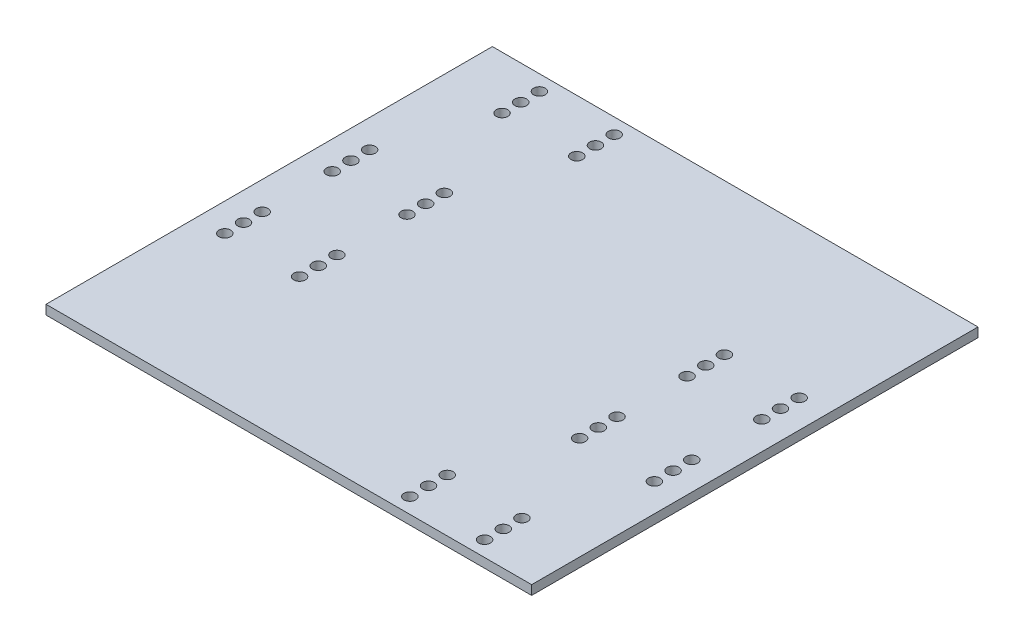
from build123d import *

# Parameters (mm, degrees)
CROQUIS1_W              = 330
CROQUIS1_H              = 303.31
SALIENTE_EXTRUIR2_DEPTH = 6.35
CROQUIS4_R              = 3.96875
CORTAR_EXTRUIR1_DEPTH   = 10


with BuildPart() as part:
    # Croquis1 → Saliente-Extruir2 (new body)
    with BuildSketch(Plane(origin=(0, 0, 0), x_dir=(1, 0, 0), z_dir=(0, 1, 0))):
        Rectangle(CROQUIS1_W, CROQUIS1_H)
    extrude(amount=SALIENTE_EXTRUIR2_DEPTH)

    # Croquis4 → Cortar-Extruir1 (cut)
    with BuildSketch(Plane(origin=(0, 6.35, 0), x_dir=(1, 0, 0), z_dir=(0, 1, 0))):
        with Locations(Location((122.58, -128.507, 0), (0, 0, 270))):
            Circle(CROQUIS4_R)
        with Locations(Location((122.58, -115.807, 0), (0, 0, 270))):
            Circle(CROQUIS4_R)
        with Locations(Location((122.58, -141.207, 0), (0, 0, 270))):
            Circle(CROQUIS4_R)
        with Locations(Location((71.78, -141.207, 0), (0, 0, 270))):
            Circle(CROQUIS4_R)
        with Locations(Location((71.78, -128.507, 0), (0, 0, 270))):
            Circle(CROQUIS4_R)
        with Locations(Location((71.78, -115.807, 0), (0, 0, 270))):
            Circle(CROQUIS4_R)
        with Locations(Location((95.15, -36.499, 0), (0, 0, 270))):
            Circle(CROQUIS4_R)
        with Locations(Location((95.15, -23.799, 0), (0, 0, 270))):
            Circle(CROQUIS4_R)
        with Locations(Location((95.15, -49.199, 0), (0, 0, 270))):
            Circle(CROQUIS4_R)
        with Locations(Location((145.95, -49.199, 0), (0, 0, 270))):
            Circle(CROQUIS4_R)
        with Locations(Location((145.95, -36.499, 0), (0, 0, 270))):
            Circle(CROQUIS4_R)
        with Locations(Location((145.95, -23.799, 0), (0, 0, 270))):
            Circle(CROQUIS4_R)
        with Locations(Location((145.95, 49.199, 0), (0, 0, 270))):
            Circle(CROQUIS4_R)
        with Locations(Location((95.15, 49.199, 0), (0, 0, 270))):
            Circle(CROQUIS4_R)
        with Locations(Location((145.95, 36.499, 0), (0, 0, 270))):
            Circle(CROQUIS4_R)
        with Locations(Location((95.15, 36.499, 0), (0, 0, 270))):
            Circle(CROQUIS4_R)
        with Locations(Location((145.95, 23.799, 0), (0, 0, 270))):
            Circle(CROQUIS4_R)
        with Locations(Location((95.15, 23.799, 0), (0, 0, 270))):
            Circle(CROQUIS4_R)
        with Locations(Location((-95.15, -49.199, 0), (0, 0, 270))):
            Circle(CROQUIS4_R)
        with Locations(Location((-145.95, -49.199, 0), (0, 0, 270))):
            Circle(CROQUIS4_R)
        with Locations(Location((-145.95, -36.499, 0), (0, 0, 270))):
            Circle(CROQUIS4_R)
        with Locations(Location((-95.15, -36.499, 0), (0, 0, 270))):
            Circle(CROQUIS4_R)
        with Locations(Location((-95.15, -23.799, 0), (0, 0, 270))):
            Circle(CROQUIS4_R)
        with Locations(Location((-145.95, -23.799, 0), (0, 0, 270))):
            Circle(CROQUIS4_R)
        with Locations(Location((-145.95, 49.199, 0), (0, 0, 270))):
            Circle(CROQUIS4_R)
        with Locations(Location((-145.95, 36.499, 0), (0, 0, 270))):
            Circle(CROQUIS4_R)
        with Locations(Location((-145.95, 23.799, 0), (0, 0, 270))):
            Circle(CROQUIS4_R)
        with Locations(Location((-95.15, 23.799, 0), (0, 0, 270))):
            Circle(CROQUIS4_R)
        with Locations(Location((-95.15, 36.499, 0), (0, 0, 270))):
            Circle(CROQUIS4_R)
        with Locations(Location((-95.15, 49.199, 0), (0, 0, 270))):
            Circle(CROQUIS4_R)
        with Locations(Location((-122.58, 115.807, 0), (0, 0, 270))):
            Circle(CROQUIS4_R)
        with Locations(Location((-122.58, 128.507, 0), (0, 0, 270))):
            Circle(CROQUIS4_R)
        with Locations(Location((-122.58, 141.207, 0), (0, 0, 270))):
            Circle(CROQUIS4_R)
        with Locations(Location((-71.78, 115.807, 0), (0, 0, 270))):
            Circle(CROQUIS4_R)
        with Locations(Location((-71.78, 128.507, 0), (0, 0, 270))):
            Circle(CROQUIS4_R)
        with Locations(Location((-71.78, 141.207, 0), (0, 0, 270))):
            Circle(CROQUIS4_R)
    extrude(amount=-CORTAR_EXTRUIR1_DEPTH, mode=Mode.SUBTRACT)


solid = part.part
